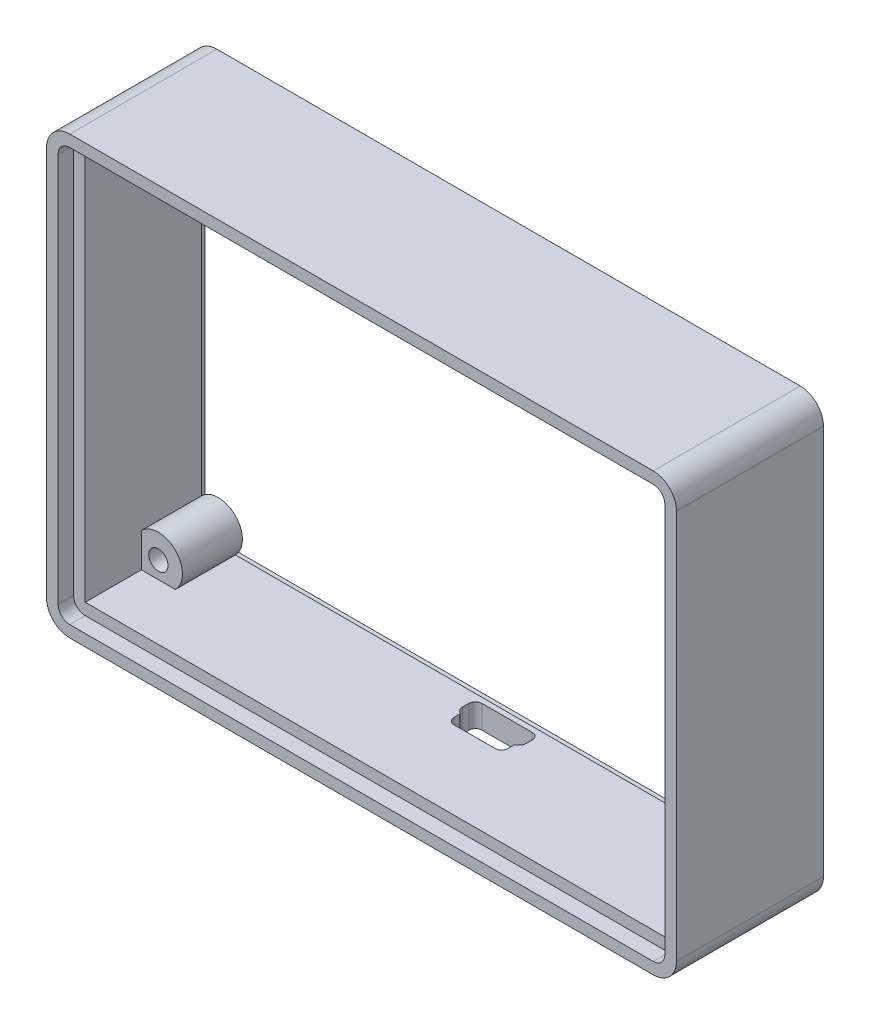
from build123d import *

# Parameters (mm, degrees)
BOSS_EXTRUDE1_START = -2
SKETCH1_W           = 81.4
SKETCH1_H           = 56.4
SKETCH1_W_2         = 75.4
SKETCH1_H_2         = 50.4
BOSS_EXTRUDE1_DEPTH = 27
FILLET1_R           = 3
SKETCH2_R           = 1.3
CUT_EXTRUDE1_DEPTH  = 2
CUT_EXTRUDE2_START  = -17
SKETCH2_3_R         = 1.3
CUT_EXTRUDE2_DEPTH  = 10
BOSS_EXTRUDE2_START = -7.25
SKETCH3_R           = 1.25
BOSS_EXTRUDE2_DEPTH = 7.75
CUT_EXTRUDE3_DEPTH  = 28.2
CUT_EXTRUDE4_START  = -8
CUT_EXTRUDE4_DEPTH  = 8


with BuildPart() as part:
    # Sketch1 → Boss-Extrude1 (new body)
    with BuildSketch(Plane.XY.offset(BOSS_EXTRUDE1_START)):
        with Locations((-9.535141298, 0.724362859)):
            Rectangle(SKETCH1_W, SKETCH1_H)
        with Locations((-9.535141298, 0.724362859)):
            Rectangle(SKETCH1_W_2, SKETCH1_H_2, mode=Mode.SUBTRACT)
    extrude(amount=-BOSS_EXTRUDE1_DEPTH)

    # Fillet1
    fillet1_edges = [part.edges().sort_by_distance(p)[0] for p in [
        (-50.235141298, -27.475637141, -15.5),
        (-50.235141298, 28.924362859, -15.5),
        (31.164858702, 28.924362859, -15.5),
        (31.164858702, -27.475637141, -15.5),
    ]]
    fillet(fillet1_edges, radius=FILLET1_R)

    # Sketch2 → Cut-Extrude1 (cut)
    with BuildSketch(Plane.XY.offset(-2)):
        with Locations((25.964858702, -22.275637141)):
            Circle(SKETCH2_R)
        with BuildLine():
            Line((28.164858702, 27.424362859), (-47.235141298, 27.424362859))
            ThreePointArc((-47.235141298, 27.424362859), (-48.29580147, 26.985023031), (-48.735141298, 25.924362859))
            Line((-48.735141298, 25.924362859), (-48.735141298, -24.475637141))
            ThreePointArc((-48.735141298, -24.475637141), (-48.29580147, -25.536297313), (-47.235141298, -25.975637141))
            Line((-47.235141298, -25.975637141), (28.164858702, -25.975637141))
            ThreePointArc((28.164858702, -25.975637141), (29.225518873, -25.536297313), (29.664858702, -24.475637141))
            Line((29.664858702, -24.475637141), (29.664858702, 25.924362859))
            ThreePointArc((29.664858702, 25.924362859), (29.225518873, 26.985023031), (28.164858702, 27.424362859))
        make_face()
    extrude(amount=-CUT_EXTRUDE1_DEPTH, mode=Mode.SUBTRACT)

    # Sketch2<3> → Cut-Extrude2 (cut)
    with BuildSketch(Plane.XY.offset(-2).offset(CUT_EXTRUDE2_START)):
        with BuildLine():
            Line((28.164858702, 27.424362859), (-47.235141298, 27.424362859))
            ThreePointArc((-47.235141298, 27.424362859), (-48.29580147, 26.985023031), (-48.735141298, 25.924362859))
            Line((-48.735141298, 25.924362859), (-48.735141298, -24.475637141))
            ThreePointArc((-48.735141298, -24.475637141), (-48.29580147, -25.536297313), (-47.235141298, -25.975637141))
            Line((-47.235141298, -25.975637141), (28.164858702, -25.975637141))
            ThreePointArc((28.164858702, -25.975637141), (29.225518873, -25.536297313), (29.664858702, -24.475637141))
            Line((29.664858702, -24.475637141), (29.664858702, 25.924362859))
            ThreePointArc((29.664858702, 25.924362859), (29.225518873, 26.985023031), (28.164858702, 27.424362859))
        make_face()
        with Locations((25.964858702, 23.724362859)):
            Circle(SKETCH2_3_R, mode=Mode.SUBTRACT)
        with Locations((-45.035141298, 23.724362859)):
            Circle(SKETCH2_3_R, mode=Mode.SUBTRACT)
        with Locations((-45.035141298, -22.275637141)):
            Circle(SKETCH2_3_R, mode=Mode.SUBTRACT)
        with Locations((25.964858702, -22.275637141)):
            Circle(SKETCH2_3_R, mode=Mode.SUBTRACT)
    extrude(amount=-CUT_EXTRUDE2_DEPTH, mode=Mode.SUBTRACT)

    # Sketch3 → Boss-Extrude2 (add)
    # profile 1 of 4: a face of its own
    with BuildSketch(Plane.XY.offset(-4).offset(BOSS_EXTRUDE2_START)):
        with BuildLine():
            Line((-47.235141298, -24.475637141), (-42.835141298, -24.475637141))
            ThreePointArc((-42.835141298, -24.475637141), (-42.160702776, -23.466268561), (-41.923871461, -22.275637141))
            ThreePointArc((-41.923871461, -22.275637141), (-43.844509878, -19.401198618), (-47.235141298, -20.075637141))
            Line((-47.235141298, -20.075637141), (-47.235141298, -24.475637141))
        make_face()
        with Locations((-45.035141298, -22.275637141)):
            Circle(SKETCH3_R, mode=Mode.SUBTRACT)
    # profile 2 of 4: a face of its own
    with BuildSketch(Plane.XY.offset(-4).offset(BOSS_EXTRUDE2_START)):
        with BuildLine():
            ThreePointArc((-41.923871461, 23.724362859), (-42.160702776, 24.914994279), (-42.835141298, 25.924362859))
            Line((-42.835141298, 25.924362859), (-47.235141298, 25.924362859))
            Line((-47.235141298, 25.924362859), (-47.235141298, 21.524362859))
            ThreePointArc((-47.235141298, 21.524362859), (-43.844509878, 20.849924336), (-41.923871461, 23.724362859))
        make_face()
        with Locations((-45.035141298, 23.724362859)):
            Circle(SKETCH3_R, mode=Mode.SUBTRACT)
    # profile 3 of 4: a face of its own
    with BuildSketch(Plane.XY.offset(-4).offset(BOSS_EXTRUDE2_START)):
        with BuildLine():
            ThreePointArc((23.764858702, 25.924362859), (23.764858702, 21.524362859), (28.164858702, 21.524362859))
            Line((28.164858702, 21.524362859), (28.164858702, 25.924362859))
            Line((28.164858702, 25.924362859), (23.764858702, 25.924362859))
        make_face()
        with Locations((25.964858702, 23.724362859)):
            Circle(SKETCH3_R, mode=Mode.SUBTRACT)
    # profile 4 of 4: a face of its own
    with BuildSketch(Plane.XY.offset(-4).offset(BOSS_EXTRUDE2_START)):
        with BuildLine():
            Line((23.764858702, -24.475637141), (28.164858702, -24.475637141))
            Line((28.164858702, -24.475637141), (28.164858702, -20.075637141))
            ThreePointArc((28.164858702, -20.075637141), (23.764858702, -20.075637141), (23.764858702, -24.475637141))
        make_face()
        with Locations((25.964858702, -22.275637141)):
            Circle(SKETCH3_R, mode=Mode.SUBTRACT)
    extrude(amount=-BOSS_EXTRUDE2_DEPTH)

    # Sketch5 → Cut-Extrude3 (cut)
    with BuildSketch(Plane.XZ.offset(27.475637141)):
        with BuildLine():
            Line((-10.285143265, -18.312481798), (-3.785143265, -18.312481798))
            ThreePointArc((-3.785143265, -18.312481798), (-3.184102501, -18.063522562), (-2.935143265, -17.462481798))
            Line((-2.935143265, -17.462481798), (-2.935143265, -16.642481798))
            ThreePointArc((-2.935143265, -16.642481798), (-3.025595699, -16.260922505), (-3.277702075, -15.960570192))
            Line((-3.277702075, -15.960570192), (-3.489691711, -15.80281914))
            ThreePointArc((-3.489691711, -15.80281914), (-3.534181071, -15.749815791), (-3.550143265, -15.682481798))
            Line((-3.550143265, -15.682481798), (-3.550143265, -14.962481798))
            ThreePointArc((-3.550143265, -14.962481798), (-3.799102501, -14.361441034), (-4.400143265, -14.112481798))
            Line((-4.400143265, -14.112481798), (-9.670143265, -14.112481798))
            ThreePointArc((-9.670143265, -14.112481798), (-10.271184029, -14.361441034), (-10.520143265, -14.962481798))
            Line((-10.520143265, -14.962481798), (-10.520143265, -15.682481798))
            ThreePointArc((-10.520143265, -15.682481798), (-10.53610546, -15.749815791), (-10.58059482, -15.80281914))
            Line((-10.58059482, -15.80281914), (-10.792584456, -15.960570192))
            ThreePointArc((-10.792584456, -15.960570192), (-11.044690832, -16.260922505), (-11.135143265, -16.642481798))
            Line((-11.135143265, -16.642481798), (-11.135143265, -17.462481798))
            ThreePointArc((-11.135143265, -17.462481798), (-10.886184029, -18.063522562), (-10.285143265, -18.312481798))
        make_face()
    extrude(amount=-CUT_EXTRUDE3_DEPTH, mode=Mode.SUBTRACT)

    # Sketch6 → Cut-Extrude4 (cut)
    with BuildSketch(Plane(origin=(0, 0, -29), x_dir=(-1, 0, 0), z_dir=(0, 0, -1)).offset(CUT_EXTRUDE4_START)):
        with BuildLine():
            Line((50.235141298, -24.475637141), (50.235141298, 25.924362859))
            ThreePointArc((50.235141298, 25.924362859), (49.356461642, 28.045683202), (47.235141298, 28.924362859))
            Line((47.235141298, 28.924362859), (-28.164858702, 28.924362859))
            ThreePointArc((-28.164858702, 28.924362859), (-30.286179045, 28.045683202), (-31.164858702, 25.924362859))
            Line((-31.164858702, 25.924362859), (-31.164858702, -24.475637141))
            ThreePointArc((-31.164858702, -24.475637141), (-30.286179045, -26.596957485), (-28.164858702, -27.475637141))
            Line((-28.164858702, -27.475637141), (47.235141298, -27.475637141))
            ThreePointArc((47.235141298, -27.475637141), (49.356461642, -26.596957485), (50.235141298, -24.475637141))
        make_face()
        with BuildLine():
            Line((-29.664858702, 25.924362859), (-29.664858702, -24.475637141))
            ThreePointArc((-29.664858702, -24.475637141), (-29.225518873, -25.536297313), (-28.164858702, -25.975637141))
            Line((-28.164858702, -25.975637141), (47.235141298, -25.975637141))
            ThreePointArc((47.235141298, -25.975637141), (48.29580147, -25.536297313), (48.735141298, -24.475637141))
            Line((48.735141298, -24.475637141), (48.735141298, 25.924362859))
            ThreePointArc((48.735141298, 25.924362859), (48.29580147, 26.985023031), (47.235141298, 27.424362859))
            Line((47.235141298, 27.424362859), (-28.164858702, 27.424362859))
            ThreePointArc((-28.164858702, 27.424362859), (-29.225518873, 26.985023031), (-29.664858702, 25.924362859))
        make_face(mode=Mode.SUBTRACT)
    extrude(amount=CUT_EXTRUDE4_DEPTH, mode=Mode.SUBTRACT)


solid = part.part
